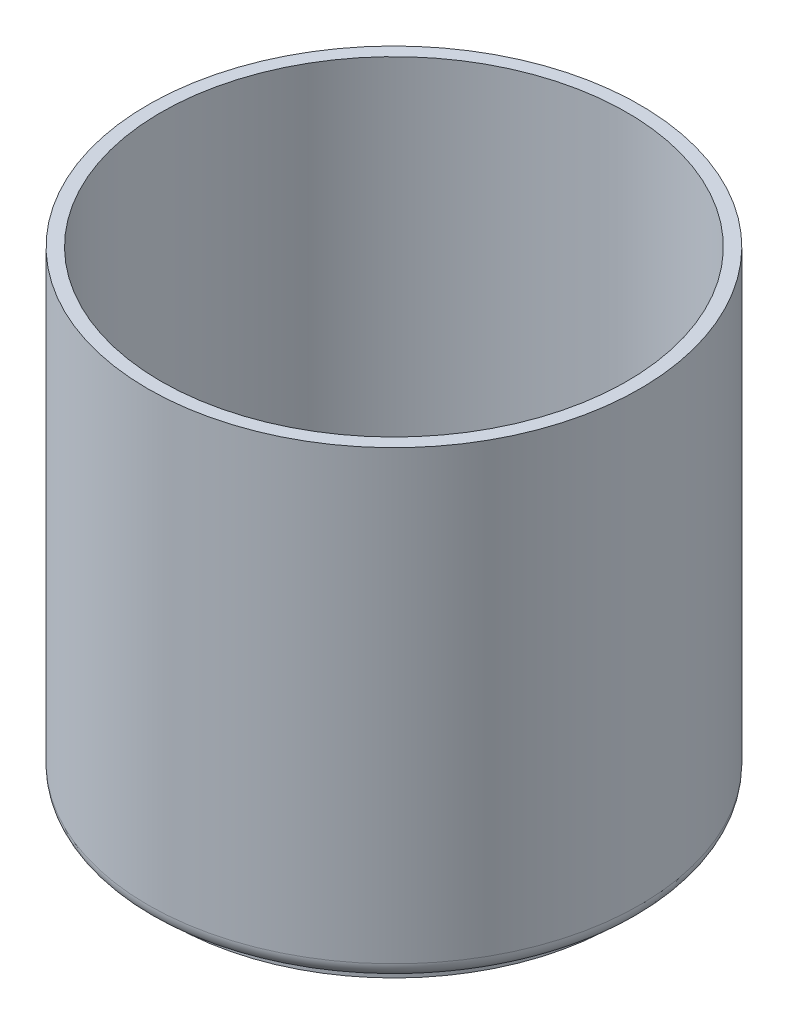
from build123d import *

# Parameters (mm, degrees)
SKETCH1_R           = 86.36
SKETCH1_R_2         = 80.518
BOSS_EXTRUDE1_DEPTH = 5.08
SKETCH2_R           = 95.758
BOSS_EXTRUDE2_DEPTH = 5.08
SKETCH3_R           = 95.758
SKETCH3_R_2         = 90.678
BOSS_EXTRUDE3_DEPTH = 175.26
FILLET1_R           = 6.35


with BuildPart() as part:
    # Sketch1 → Boss-Extrude1 (new body)
    with BuildSketch(Plane(origin=(0, 0, 0), x_dir=(1, 0, 0), z_dir=(0, 1, 0))):
        with Locations(Location((0, 0, 0), (0, 0, 270))):
            Circle(SKETCH1_R)
        with Locations(Location((0, 0, 0), (0, 0, 270))):
            Circle(SKETCH1_R_2, mode=Mode.SUBTRACT)
    extrude(amount=BOSS_EXTRUDE1_DEPTH)

    # Sketch2 → Boss-Extrude2 (add)
    with BuildSketch(Plane(origin=(0, 5.08, 0), x_dir=(1, 0, 0), z_dir=(0, 1, 0))):
        with Locations(Location((0, 0, 0), (0, 0, 270))):
            Circle(SKETCH2_R)
    extrude(amount=BOSS_EXTRUDE2_DEPTH)

    # Sketch3 → Boss-Extrude3 (add)
    with BuildSketch(Plane(origin=(0, 10.16, 0), x_dir=(1, 0, 0), z_dir=(0, 1, 0))):
        with Locations(Location((0, 0, 0), (0, 0, 270))):
            Circle(SKETCH3_R)
        with Locations(Location((0, 0, 0), (0, 0, 270))):
            Circle(SKETCH3_R_2, mode=Mode.SUBTRACT)
    extrude(amount=BOSS_EXTRUDE3_DEPTH)

    # Fillet1
    fillet1_edges = [part.edges().sort_by_distance(p)[0] for p in [
        (0, 10.16, -90.678),
        (0, 5.08, -95.758),
    ]]
    fillet(fillet1_edges, radius=FILLET1_R)


solid = part.part
